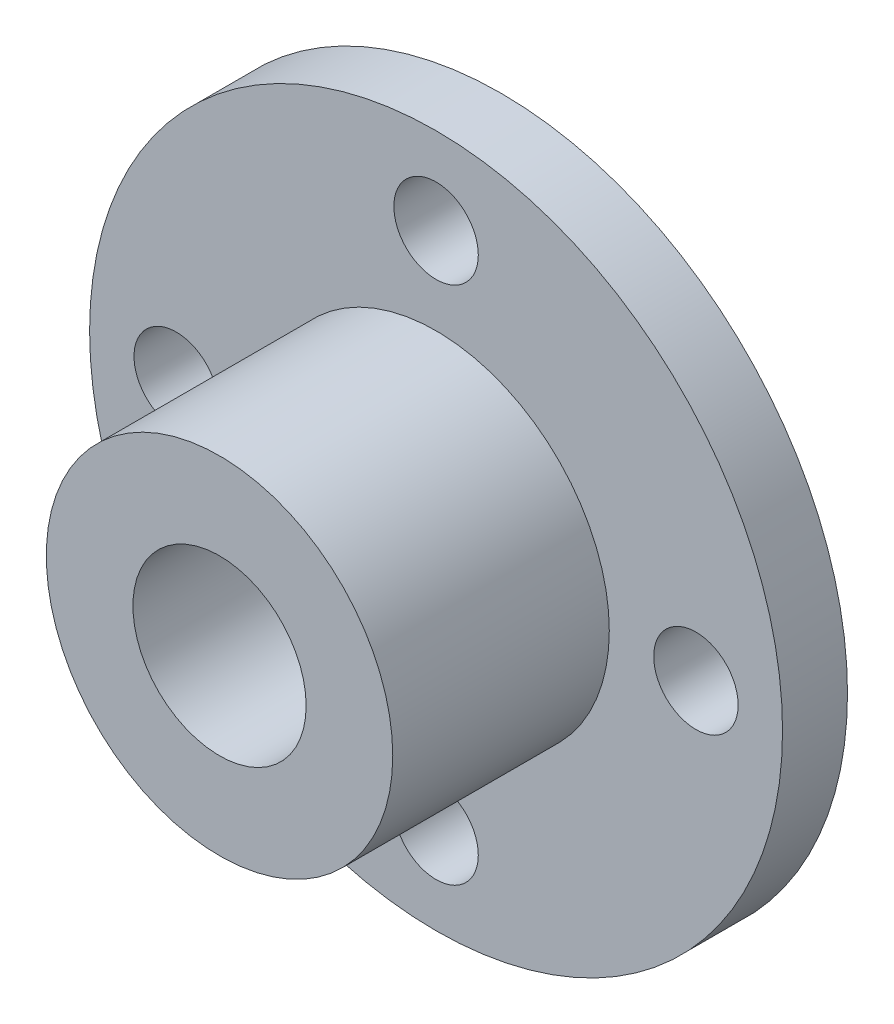
from build123d import *

# Parameters (mm, degrees)
CROQUIS1_R              = 16
SALIENTE_EXTRUIR1_DEPTH = 3
CROQUIS2_R              = 8
CROQUIS2_R_2            = 4
SALIENTE_EXTRUIR2_DEPTH = 10
CROQUIS3_R              = 1.95
CORTAR_EXTRUIR1_DEPTH   = 3


with BuildPart() as part:
    # Croquis1 → Saliente-Extruir1 (new body)
    with BuildSketch(Plane.XY):
        Circle(CROQUIS1_R)
    extrude(amount=SALIENTE_EXTRUIR1_DEPTH)

    # Croquis2 → Saliente-Extruir2 (add)
    with BuildSketch(Plane.XY.offset(3)):
        Circle(CROQUIS2_R)
        Circle(CROQUIS2_R_2, mode=Mode.SUBTRACT)
    extrude(amount=SALIENTE_EXTRUIR2_DEPTH)

    # Croquis3 → Cortar-Extruir1 (cut)
    with BuildSketch(Plane.XY.offset(3)):
        with Locations((0, 12)):
            Circle(CROQUIS3_R)
        with Locations((12, 0)):
            Circle(CROQUIS3_R)
        with Locations((0, -12)):
            Circle(CROQUIS3_R)
        with Locations((-12, 0)):
            Circle(CROQUIS3_R)
    extrude(amount=-CORTAR_EXTRUIR1_DEPTH, mode=Mode.SUBTRACT)


solid = part.part
